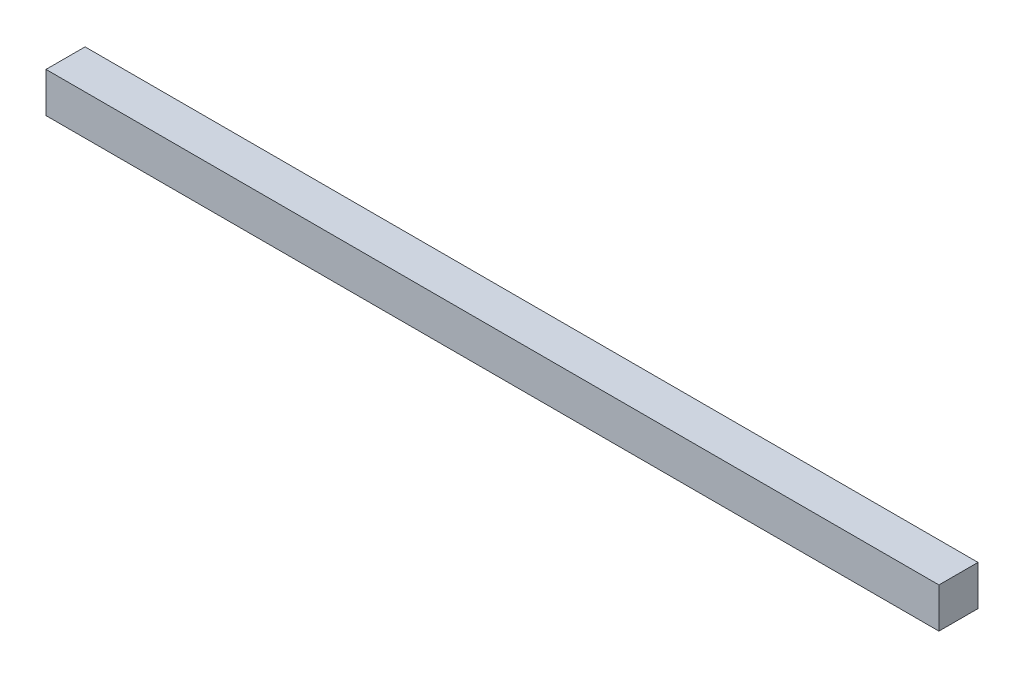
from build123d import *

# Parameters (mm, degrees)
SKETCH_1384_W      = 137.175
SKETCH_1384_H      = 6.15
EXTRUDE_1392_DEPTH = 6


with BuildPart() as part:
    # Sketch 1384 → Extrude 1392 (new body)
    with BuildSketch(Plane.XY):
        with Locations((68.4875, 0)):
            Rectangle(SKETCH_1384_W, SKETCH_1384_H)
    extrude(amount=EXTRUDE_1392_DEPTH)


solid = part.part
